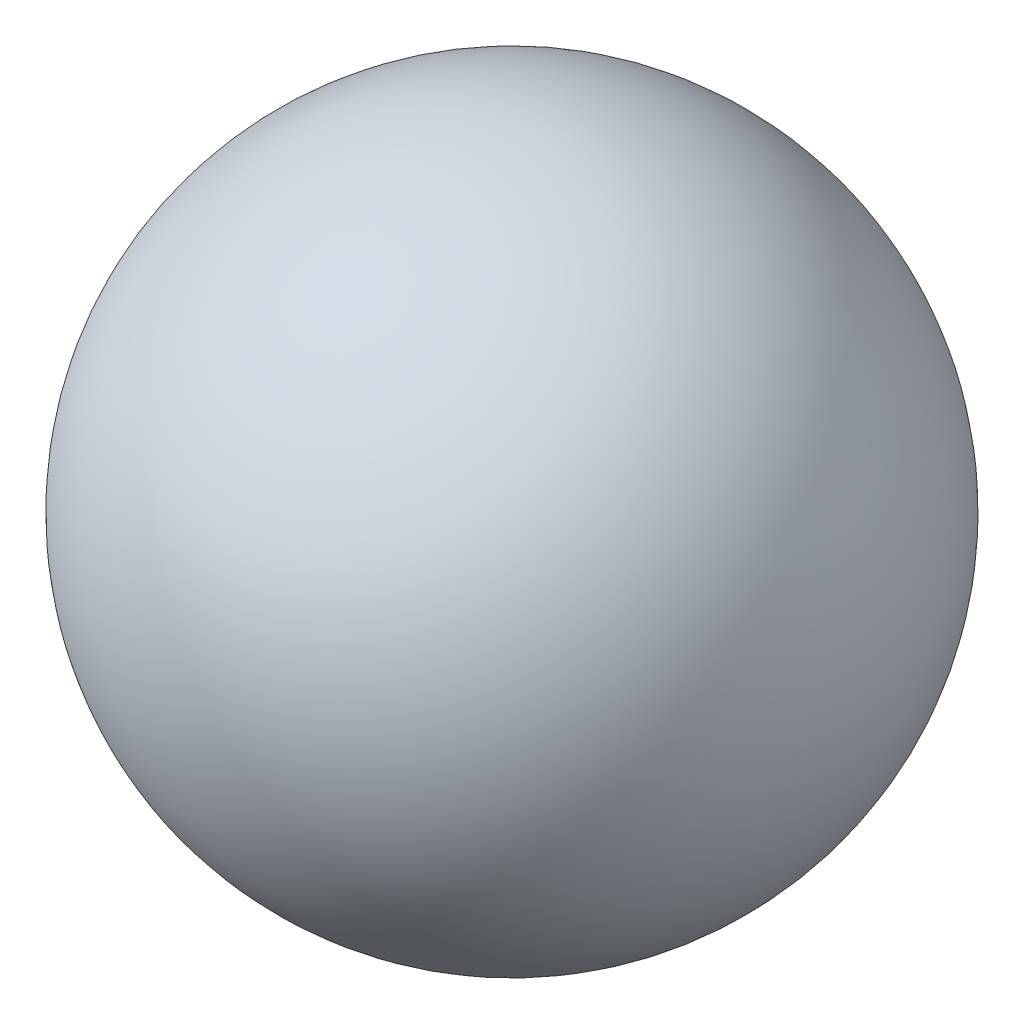
from build123d import *


with BuildPart() as part:
    # Sketch1 → Revolve4 (revolve)
    with BuildSketch(Plane(origin=(0, 0, 0), x_dir=(1, 0, 0), z_dir=(0, 1, 0))):
        with BuildLine():
            Line((0, 6.35), (0, -6.35))
            ThreePointArc((0, -6.35), (6.35, 0), (0, 6.35))
        make_face()
    revolve(axis=Axis((0, 0, -6.35), (0, 0, 1)))


solid = part.part
